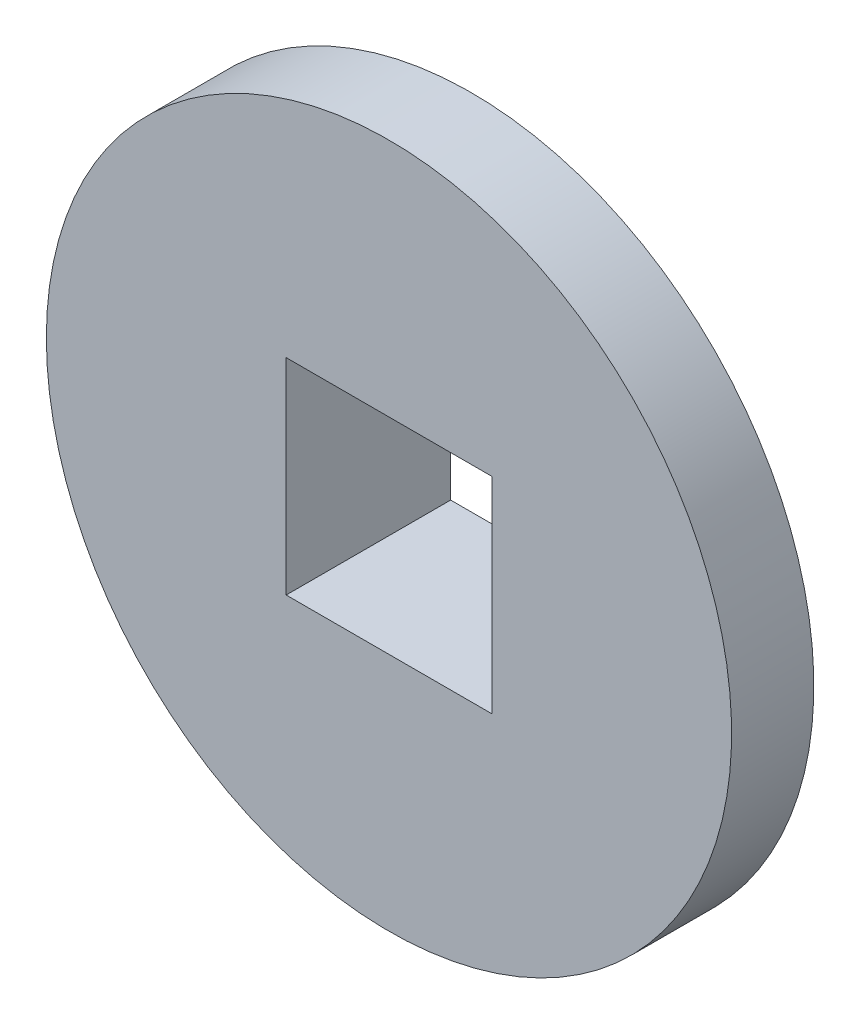
from build123d import *

# Parameters (mm, degrees)
SKETCH1_R           = 15.875
BOSS_EXTRUDE1_DEPTH = 3.81
SKETCH2_R           = 9.144
BOSS_EXTRUDE2_DEPTH = 3.81
SKETCH3_W           = 9.525
SKETCH3_H           = 9.525
CUT_EXTRUDE1_DEPTH  = 9.652


with BuildPart() as part:
    # Sketch1 → Boss-Extrude1 (new body)
    with BuildSketch(Plane.XY):
        with Locations(Location((-130.201551665, 15.077630219, 0), (0, 0, 180))):
            Circle(SKETCH1_R)
    extrude(amount=BOSS_EXTRUDE1_DEPTH)

    # Sketch2 → Boss-Extrude2 (add)
    with BuildSketch(Plane(origin=(0, 0, 0), x_dir=(-1, 0, 0), z_dir=(0, 0, -1))):
        with Locations(Location((130.201551665, 15.077630219, 0), (0, 0, 180))):
            Circle(SKETCH2_R)
    extrude(amount=BOSS_EXTRUDE2_DEPTH)

    # Sketch3 → Cut-Extrude1 (cut)
    with BuildSketch(Plane(origin=(0, 0, -3.81), x_dir=(-1, 0, 0), z_dir=(0, 0, -1))):
        with Locations((130.201551665, 15.077630219)):
            Rectangle(SKETCH3_W, SKETCH3_H)
    extrude(amount=-CUT_EXTRUDE1_DEPTH, mode=Mode.SUBTRACT)


solid = part.part
